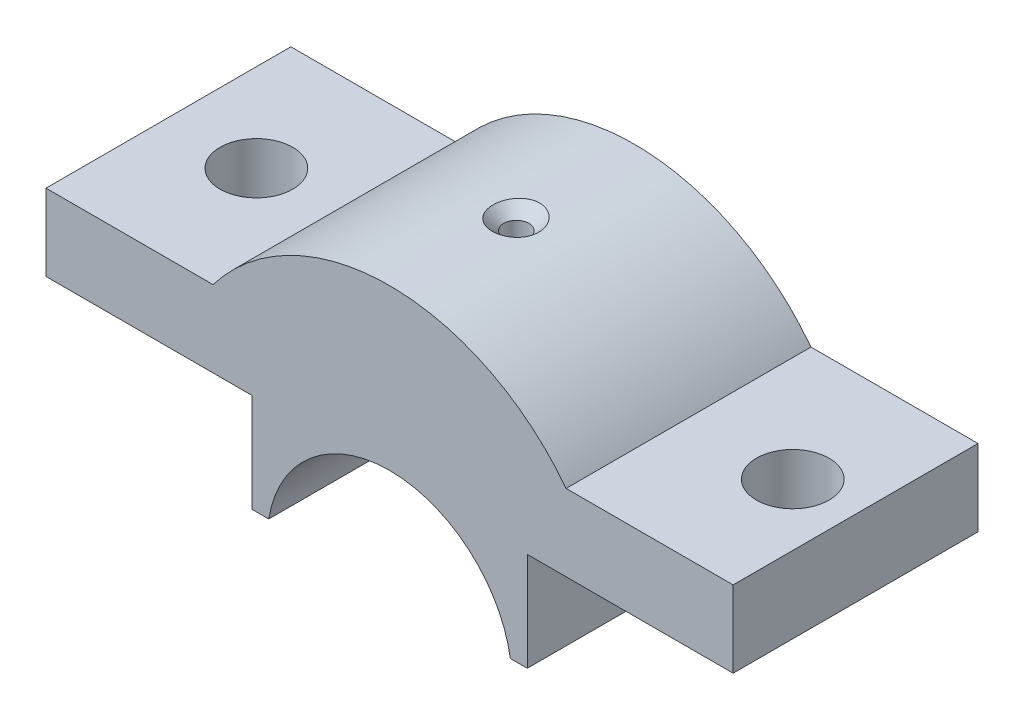
from build123d import *

# Parameters (mm, degrees)
BOSS_EXTRUDE1_DEPTH                                 = 64
F_1_0MM_DOWEL_HOLE1_D                               = 19
F_1_0MM_DOWEL_HOLE1_DEPTH                           = 130
F_1_0MM_DOWEL_HOLE1_TIP                             = 5.708175881
CSK_FOR_M6_COUNTERSUNK_FLAT_HEAD_SCREW1_D           = 6.6
CSK_FOR_M6_COUNTERSUNK_FLAT_HEAD_SCREW1_DEPTH       = 130
CSK_FOR_M6_COUNTERSUNK_FLAT_HEAD_SCREW1_CSINK_D     = 12.6
CSK_FOR_M6_COUNTERSUNK_FLAT_HEAD_SCREW1_CSINK_ANGLE = 90
CSK_FOR_M6_COUNTERSUNK_FLAT_HEAD_SCREW1_TIP         = 1.982840043


with BuildPart() as part:
    # Sketch1 → Boss-Extrude1 (new body)
    with BuildSketch(Plane.XY):
        with BuildLine():
            Line((0, 0), (0, 20))
            Line((0, 20), (43.660658251, 20))
            ThreePointArc((43.660658251, 20), (89.797593381, 42.851981325), (135.934528511, 20))
            Line((135.934528511, 20), (179.595186762, 20))
            Line((179.595186762, 20), (179.595186762, 0))
            Line((179.595186762, 0), (125.797593381, 0))
            Line((125.797593381, 0), (125.797593381, -25.778358914))
            Line((125.797593381, -25.778358914), (121.37101897, -25.778358914))
            ThreePointArc((121.37101897, -25.778358914), (89.797593381, 1.014070006), (58.224167792, -25.778358914))
            Line((58.224167792, -25.778358914), (53.797593381, -25.778358914))
            Line((53.797593381, -25.778358914), (53.797593381, 0))
            Line((53.797593381, 0), (0, 0))
        make_face()
    extrude(amount=BOSS_EXTRUDE1_DEPTH)

    # Ø1.0mm Dowel Hole1
    with Locations(Plane(origin=(0, 20, 0), x_dir=(1, 0, 0), z_dir=(0, 1, 0))):
        with Locations((22.988007273, -32), (163.454699395, -32.277602158)):
            Hole(F_1_0MM_DOWEL_HOLE1_D / 2, depth=F_1_0MM_DOWEL_HOLE1_DEPTH)
            with Locations((0, 0, -(F_1_0MM_DOWEL_HOLE1_DEPTH + F_1_0MM_DOWEL_HOLE1_TIP / 2))):  # 118° drill point
                Cone(0, F_1_0MM_DOWEL_HOLE1_D / 2, F_1_0MM_DOWEL_HOLE1_TIP, mode=Mode.SUBTRACT)

    # CSK for M6 Countersunk Flat Head Screw1
    with Locations(Plane(origin=(0, 42.851981325, 0), x_dir=(1, 0, 0), z_dir=(0, 1, 0))):
        with Locations((90.934528511, -32)):
            CounterSinkHole(CSK_FOR_M6_COUNTERSUNK_FLAT_HEAD_SCREW1_D / 2, CSK_FOR_M6_COUNTERSUNK_FLAT_HEAD_SCREW1_CSINK_D / 2, depth=CSK_FOR_M6_COUNTERSUNK_FLAT_HEAD_SCREW1_DEPTH, counter_sink_angle=CSK_FOR_M6_COUNTERSUNK_FLAT_HEAD_SCREW1_CSINK_ANGLE)
            with Locations((0, 0, -(CSK_FOR_M6_COUNTERSUNK_FLAT_HEAD_SCREW1_DEPTH + CSK_FOR_M6_COUNTERSUNK_FLAT_HEAD_SCREW1_TIP / 2))):  # 118° drill point
                Cone(0, CSK_FOR_M6_COUNTERSUNK_FLAT_HEAD_SCREW1_D / 2, CSK_FOR_M6_COUNTERSUNK_FLAT_HEAD_SCREW1_TIP, mode=Mode.SUBTRACT)


solid = part.part
